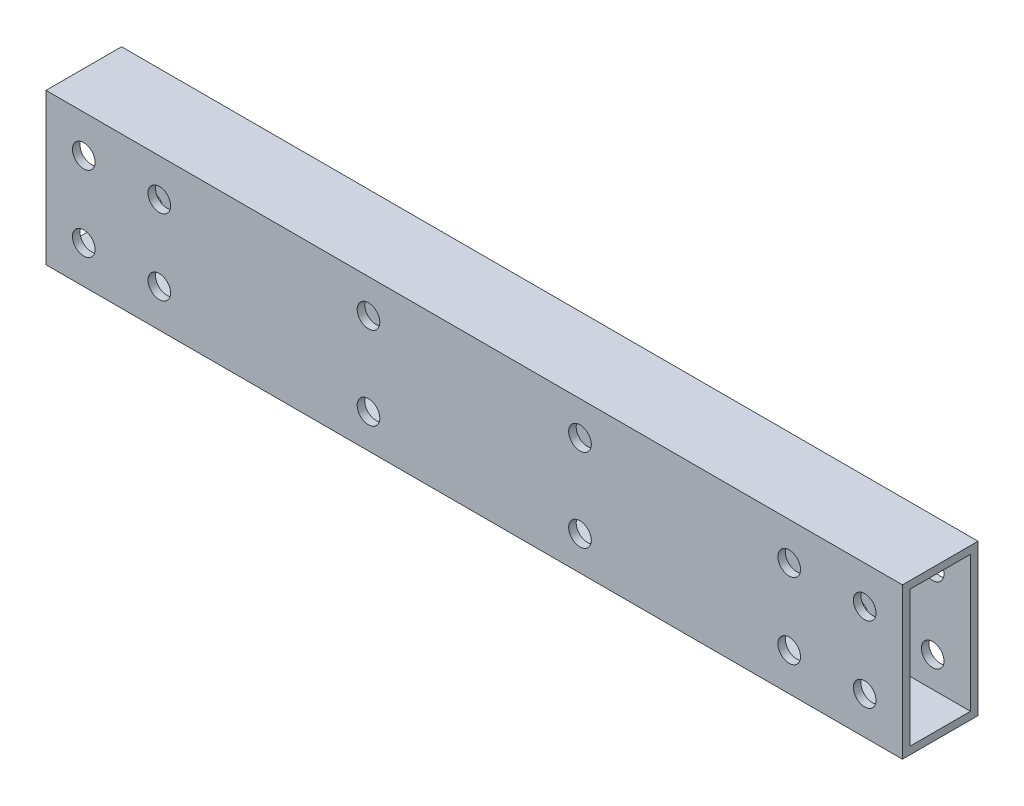
from build123d import *

# Parameters (mm, degrees)
SKETCH_11_W                = 20
SKETCH_11_H                = 10
SKETCH_11_W_2              = 18
SKETCH_11_H_2              = 8
JIQIRENDUI_20X10X1_1_DEPTH = 113.4
SKETCH_12_R                = 1.5
CUT_EXTRUDE_1_DEPTH        = 10
SKETCH_13_R                = 1.5
CUT_EXTRUDE_2_DEPTH        = 115.278431911


with BuildPart() as part:
    # 草图11 → Jiqirendui 20X10X1(1) (new body)
    with BuildSketch(Plane.YZ):
        Rectangle(SKETCH_11_W, SKETCH_11_H)
        Rectangle(SKETCH_11_W_2, SKETCH_11_H_2, mode=Mode.SUBTRACT)
    extrude(amount=JIQIRENDUI_20X10X1_1_DEPTH)

    # 草图12 → 切除-拉伸1 (cut)
    with BuildSketch(Plane.XY.offset(5)):
        with Locations((15, 5)):
            Circle(SKETCH_12_R)
        with Locations((5, 5)):
            Circle(SKETCH_12_R)
        with Locations((15, -5)):
            Circle(SKETCH_12_R)
        with Locations((5, -5)):
            Circle(SKETCH_12_R)
        with Locations((108.4, -5)):
            Circle(SKETCH_12_R)
        with Locations((108.4, 5)):
            Circle(SKETCH_12_R)
        with Locations((98.4, 5)):
            Circle(SKETCH_12_R)
        with Locations((98.4, -5)):
            Circle(SKETCH_12_R)
    extrude(amount=-CUT_EXTRUDE_1_DEPTH, mode=Mode.SUBTRACT)

    # 草图13 → 切除-拉伸2 (cut, through all)
    with BuildSketch(Plane.XY.offset(5)):
        with Locations((42.7, 5.5)):
            Circle(SKETCH_13_R)
        with Locations(Location((70.7, 5.5, 0), (0, 0, 90))):
            Circle(SKETCH_13_R)
        with Locations((70.7, -5.5)):
            Circle(SKETCH_13_R)
        with Locations(Location((42.7, -5.5, 0), (0, 0, 90))):
            Circle(SKETCH_13_R)
    extrude(amount=-CUT_EXTRUDE_2_DEPTH, mode=Mode.SUBTRACT)


solid = part.part
